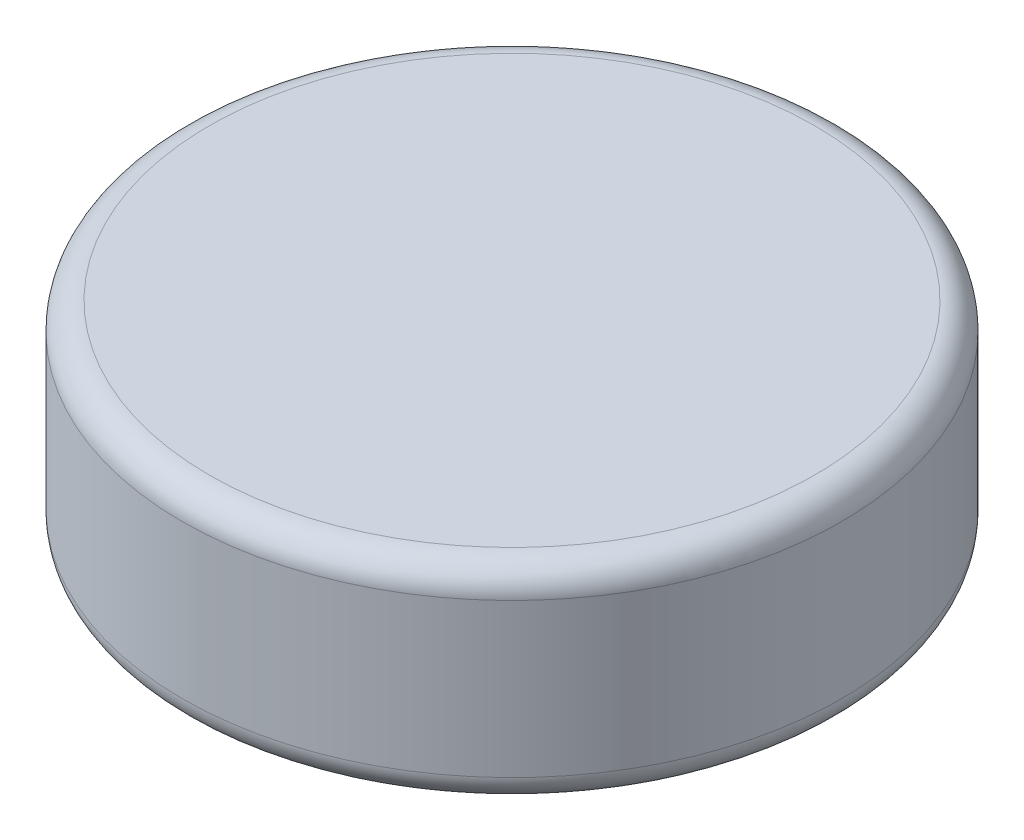
from build123d import *

# Parameters (mm, degrees)
SKETCH1_R           = 12.25
BOSS_EXTRUDE1_DEPTH = 7.7
FILLET1_R           = 1


with BuildPart() as part:
    # Sketch1 → Boss-Extrude1 (new body)
    with BuildSketch(Plane(origin=(0, 0, 0), x_dir=(1, 0, 0), z_dir=(0, 1, 0))):
        Circle(SKETCH1_R)
    extrude(amount=BOSS_EXTRUDE1_DEPTH)

    # Fillet1
    fillet1_edges = [part.edges().sort_by_distance(p)[0] for p in [
        (-12.25, 0, 0),
        (-12.25, 7.7, 0),
    ]]
    fillet(fillet1_edges, radius=FILLET1_R)


solid = part.part
